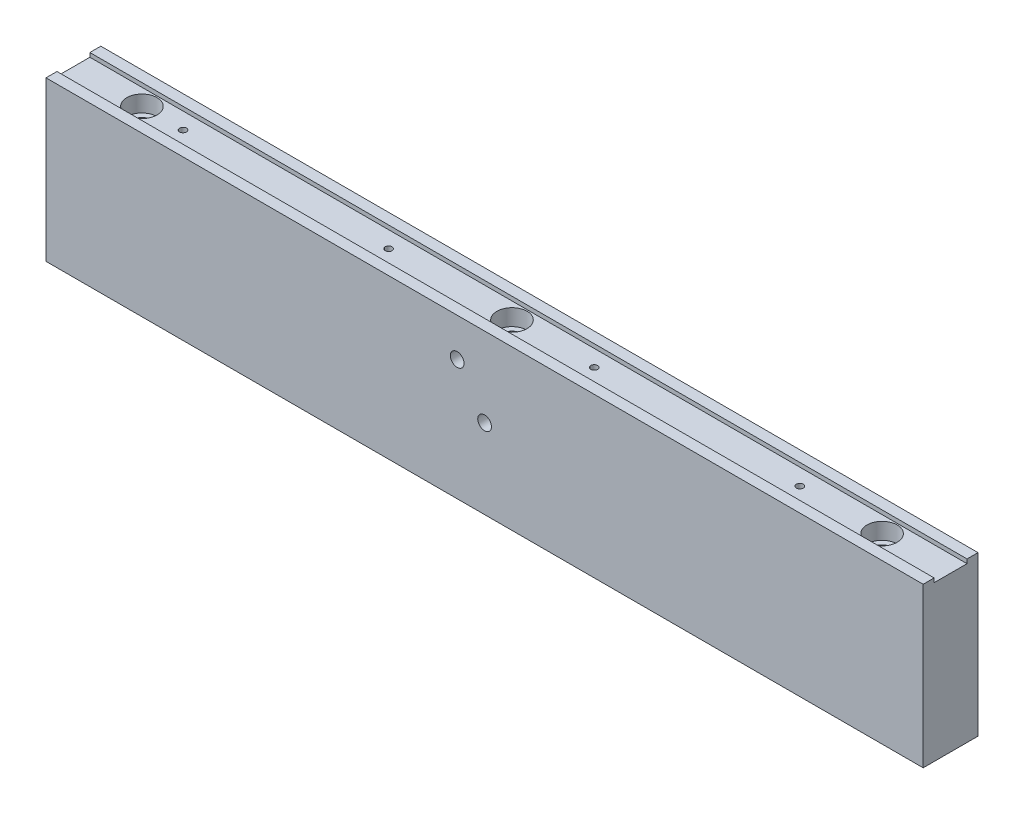
from build123d import *

# Parameters (mm, degrees)
SKETCH_1_W                     = 320
SKETCH_1_H                     = 58
EXTRUDE_1_DEPTH                = 20
SKETCH_2_W                     = 12
SKETCH_2_H                     = 1.5
CUT_EXTRUDE_1_DEPTH            = 326.828175577
HOLE_WIZARD_M6_1_D             = 5
HOLE_WIZARD_M6_1_DEPTH         = 15
HOLE_WIZARD_M6_1_TIP           = 1.502151548
HOLE_WIZARD_M6_1_2_D           = 7
HOLE_WIZARD_M6_1_2_CBORE_D     = 11
HOLE_WIZARD_M6_1_2_CBORE_DEPTH = 6
HOLE_WIZARD_M3_1_D             = 2.5
HOLE_WIZARD_M3_1_DEPTH         = 7.5
HOLE_WIZARD_M3_1_TIP           = 0.751075774
HOLE_WIZARD_M6_2_D             = 5
HOLE_WIZARD_M6_2_DEPTH         = 15
HOLE_WIZARD_M6_2_TIP           = 1.502151548
HOLE_WIZARD_M3_2_D             = 2.5
HOLE_WIZARD_M3_2_DEPTH         = 7.5
HOLE_WIZARD_M3_2_TIP           = 0.751075774


with BuildPart() as part:
    # 草图1 → 凸台-拉伸1 (new body)
    with BuildSketch(Plane.XY):
        with Locations((160, 29)):
            Rectangle(SKETCH_1_W, SKETCH_1_H)
    extrude(amount=EXTRUDE_1_DEPTH)

    # 草图2 → 切除-拉伸1 (cut, through all)
    with BuildSketch(Plane.ZY):
        with Locations((10, 57.25)):
            Rectangle(SKETCH_2_W, SKETCH_2_H)
    extrude(amount=-CUT_EXTRUDE_1_DEPTH, mode=Mode.SUBTRACT)

    # Hole Wizard M6 _1
    with Locations(Plane.XY.offset(20)):
        with Locations((160, 29), (150, 44)):
            Hole(HOLE_WIZARD_M6_1_D / 2, depth=HOLE_WIZARD_M6_1_DEPTH)
            with Locations((0, 0, -(HOLE_WIZARD_M6_1_DEPTH + HOLE_WIZARD_M6_1_TIP / 2))):  # 118° drill point
                Cone(0, HOLE_WIZARD_M6_1_D / 2, HOLE_WIZARD_M6_1_TIP, mode=Mode.SUBTRACT)

    # Hole Wizard M6 _1 2 (through all)
    with Locations(Plane(origin=(0, 56.5, 0), x_dir=(-1, 0, 0), z_dir=(0, 1, 0))):
        with Locations((-25, 10), (-295, 10), (-160, 10)):
            CounterBoreHole(HOLE_WIZARD_M6_1_2_D / 2, HOLE_WIZARD_M6_1_2_CBORE_D / 2, HOLE_WIZARD_M6_1_2_CBORE_DEPTH)

    # M3 螺纹孔1
    with Locations(Plane(origin=(0, 56.5, 0), x_dir=(-1, 0, 0), z_dir=(0, 1, 0))):
        with Locations((-265, 10), (-40, 10), (-190, 10), (-115, 10)):
            Hole(HOLE_WIZARD_M3_1_D / 2, depth=HOLE_WIZARD_M3_1_DEPTH)
            with Locations((0, 0, -(HOLE_WIZARD_M3_1_DEPTH + HOLE_WIZARD_M3_1_TIP / 2))):  # 118° drill point
                Cone(0, HOLE_WIZARD_M3_1_D / 2, HOLE_WIZARD_M3_1_TIP, mode=Mode.SUBTRACT)

    # M6 螺纹孔2
    with Locations(Plane(origin=(0, 0, 0), x_dir=(-1, 0, 0), z_dir=(0, 0, -1))):
        with Locations((-304, 46.621481833), (-276, 46.621481833)):
            Hole(HOLE_WIZARD_M6_2_D / 2, depth=HOLE_WIZARD_M6_2_DEPTH)
            with Locations((0, 0, -(HOLE_WIZARD_M6_2_DEPTH + HOLE_WIZARD_M6_2_TIP / 2))):  # 118° drill point
                Cone(0, HOLE_WIZARD_M6_2_D / 2, HOLE_WIZARD_M6_2_TIP, mode=Mode.SUBTRACT)

    # M3 螺纹孔2
    with Locations(Plane(origin=(0, 0, 0), x_dir=(-1, 0, 0), z_dir=(0, 0, -1))):
        with Locations((-10, 35.4), (-29.5, 35.4), (-244, 35.4), (-224.5, 35.4)):
            Hole(HOLE_WIZARD_M3_2_D / 2, depth=HOLE_WIZARD_M3_2_DEPTH)
            with Locations((0, 0, -(HOLE_WIZARD_M3_2_DEPTH + HOLE_WIZARD_M3_2_TIP / 2))):  # 118° drill point
                Cone(0, HOLE_WIZARD_M3_2_D / 2, HOLE_WIZARD_M3_2_TIP, mode=Mode.SUBTRACT)


solid = part.part
